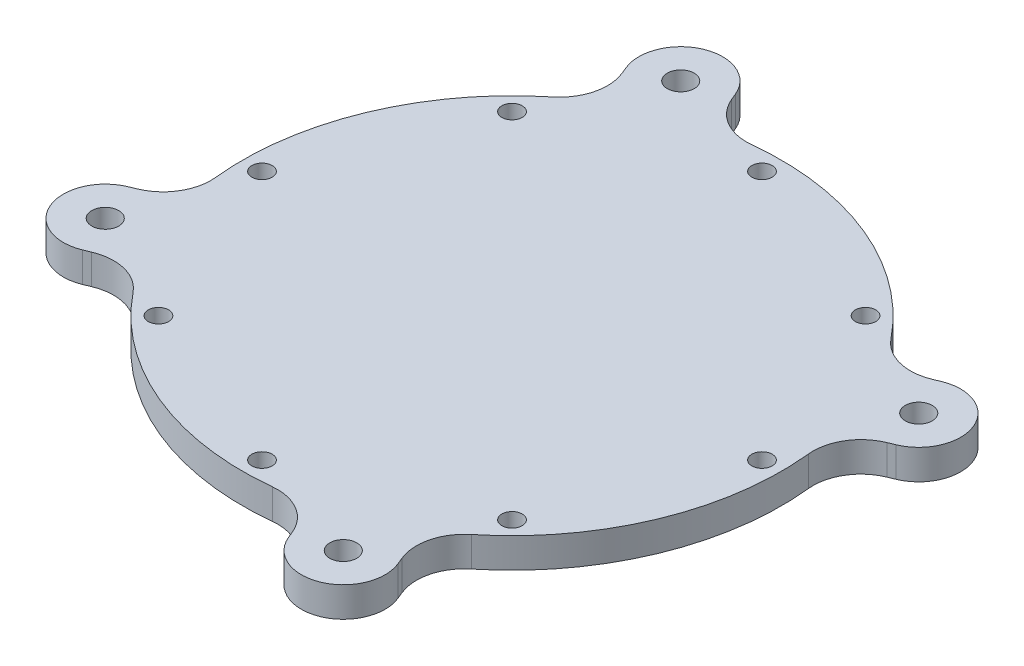
from build123d import *

# Parameters (mm, degrees)
SKETCH1_R                       = 45
SKETCH1_R_2                     = 1.5
BOSS_EXTRUDE2_DEPTH             = 5
SKETCH9_R                       = 3.937
BOSS_EXTRUDE7_DEPTH             = 4
SKETCH10_R                      = 1.7
CUT_EXTRUDE9_DEPTH              = 14
BOSS_EXTRUDE8_DEPTH             = 5
FILLET1_R                       = 8
SKETCH17_R                      = 8.317724374
BOSS_EXTRUDE9_DEPTH             = 10
CIRPATTERN1_COUNT               = 4
FILLET1_OF_CIRPATTERN1_R        = 8
CUT_EXTRUDE10_DEPTH             = 80.287191735
CUT_EXTRUDE10_DEPTH_BACK        = 80.287191735
SKETCH18_W                      = 16.635448748
SKETCH18_H                      = 10
SKETCH18_W_2                    = 61.874
SKETCH18_H_2                    = 4
M3X0_5_TAPPED_HOLE1_D           = 2.5
M3X0_5_TAPPED_HOLE1_DEPTH       = 3.248924226
M3X0_5_TAPPED_HOLE1_CSINK_D     = 3.05
M3X0_5_TAPPED_HOLE1_CSINK_ANGLE = 90
M3X0_5_TAPPED_HOLE1_TIP         = 0.751075774


with BuildPart() as part:
    # Sketch1 → Boss-Extrude2 (new body)
    with BuildSketch(Plane(origin=(0, 0, 0), x_dir=(1, 0, 0), z_dir=(0, 1, 0))):
        with Locations(Location((0, 0, 0), (0, 0, 270))):
            Circle(SKETCH1_R)
        with Locations(Location((0, 41.75, 0), (0, 0, 270))):
            Circle(SKETCH1_R_2, mode=Mode.SUBTRACT)
        with Locations(Location((29.521708115, 29.521708115, 0), (0, 0, 270))):
            Circle(SKETCH1_R_2, mode=Mode.SUBTRACT)
        with Locations(Location((41.75, 0, 0), (0, 0, 270))):
            Circle(SKETCH1_R_2, mode=Mode.SUBTRACT)
        with Locations(Location((29.521708115, -29.521708115, 0), (0, 0, 270))):
            Circle(SKETCH1_R_2, mode=Mode.SUBTRACT)
        with Locations(Location((0, -41.75, 0), (0, 0, 270))):
            Circle(SKETCH1_R_2, mode=Mode.SUBTRACT)
        with Locations(Location((-29.521708115, -29.521708115, 0), (0, 0, 270))):
            Circle(SKETCH1_R_2, mode=Mode.SUBTRACT)
        with Locations(Location((-41.75, 0, 0), (0, 0, 270))):
            Circle(SKETCH1_R_2, mode=Mode.SUBTRACT)
        with Locations(Location((-29.521708115, 29.521708115, 0), (0, 0, 270))):
            Circle(SKETCH1_R_2, mode=Mode.SUBTRACT)
    extrude(amount=BOSS_EXTRUDE2_DEPTH)

    # Sketch9 → Boss-Extrude7 (add)
    with BuildSketch(Plane.XZ):
        with Locations(Location((27, 0, 0), (0, 0, 90))):
            Circle(SKETCH9_R)
        with Locations(Location((0, -27, 0), (0, 0, 90))):
            Circle(SKETCH9_R)
        with Locations(Location((-27, 0, 0), (0, 0, 90))):
            Circle(SKETCH9_R)
        with Locations(Location((0, 27, 0), (0, 0, 90))):
            Circle(SKETCH9_R)
    extrude(amount=BOSS_EXTRUDE7_DEPTH)

    # Sketch10 → Cut-Extrude9 (cut)
    with BuildSketch(Plane(origin=(0, 5, 0), x_dir=(1, 0, 0), z_dir=(0, 1, 0))):
        with Locations(Location((0, 41.75, 0), (0, 0, 270))):
            Circle(SKETCH10_R)
        with Locations(Location((29.521708115, 29.521708115, 0), (0, 0, 270))):
            Circle(SKETCH10_R)
        with Locations(Location((41.75, 0, 0), (0, 0, 270))):
            Circle(SKETCH10_R)
        with Locations(Location((29.521708115, -29.521708115, 0), (0, 0, 270))):
            Circle(SKETCH10_R)
        with Locations(Location((0, -41.75, 0), (0, 0, 270))):
            Circle(SKETCH10_R)
        with Locations(Location((-29.521708115, -29.521708115, 0), (0, 0, 270))):
            Circle(SKETCH10_R)
        with Locations(Location((-41.75, 0, 0), (0, 0, 270))):
            Circle(SKETCH10_R)
        with Locations(Location((-29.521708115, 29.521708115, 0), (0, 0, 270))):
            Circle(SKETCH10_R)
    extrude(amount=-CUT_EXTRUDE9_DEPTH, mode=Mode.SUBTRACT)

    # Sketch16 → Boss-Extrude8 (add)
    with BuildSketch(Plane.XZ):
        with BuildLine():
            ThreePointArc((45.376634658, -26.343140039), (41.586295626, -22.556734731), (41.583514038, -17.199167429))
            ThreePointArc((41.583514038, -17.199167429), (40.114970744, -20.390907832), (38.401897955, -23.458351039))
            Line((38.401897955, -23.458351039), (45.376634658, -26.343140039))
        make_face()
        with BuildLine():
            Line((50.727486729, -13.406046775), (43.752750026, -10.521257775))
            ThreePointArc((43.752750026, -10.521257775), (42.798576033, -13.902585715), (41.583514038, -17.199167429))
            ThreePointArc((41.583514038, -17.199167429), (45.36991937, -13.408828339), (50.727486729, -13.406046775))
        make_face()
        with BuildLine():
            Line((45.972884991, -19.014635038), (41.583514062, -17.199167371))
            ThreePointArc((41.583514062, -17.199167371), (41.586295614, -22.556734702), (45.376634658, -26.343140039))
            Line((45.376634658, -26.343140039), (47.192102325, -21.95376911))
            ThreePointArc((47.192102325, -21.95376911), (45.973779061, -20.736710252), (45.972884991, -19.014635038))
        make_face()
        with BuildLine():
            ThreePointArc((50.727486729, -13.406046775), (45.369919398, -13.408828327), (41.583514062, -17.199167371))
            Line((41.583514062, -17.199167371), (45.972884991, -19.014635038))
            ThreePointArc((45.972884991, -19.014635038), (47.189943849, -17.796311774), (48.912019062, -17.795417704))
            Line((48.912019062, -17.795417704), (50.727486729, -13.406046775))
        make_face()
        with BuildLine():
            ThreePointArc((55.052060694, -19.874593407), (53.871338237, -15.984091013), (50.727486729, -13.406046775))
            Line((50.727486729, -13.406046775), (48.912019062, -17.795417704))
            ThreePointArc((48.912019062, -17.795417704), (49.922542761, -18.62407478), (50.302060694, -19.874593407))
            ThreePointArc((50.302060694, -19.874593407), (49.30257932, -21.745075474), (47.192102325, -21.95376911))
            Line((47.192102325, -21.95376911), (45.376634658, -26.343140039))
            ThreePointArc((45.376634658, -26.343140039), (51.942563088, -25.69387095), (55.052060694, -19.874593407))
        make_face()
    boss_extrude8 = extrude(amount=-BOSS_EXTRUDE8_DEPTH)

    # Fillet1
    fillet1_edges = [part.edges().sort_by_distance(p)[0] for p in [
        (38.401897955, 2.5, -23.458351039),
        (43.752750026, 2.5, -10.521257775),
    ]]
    fillet(fillet1_edges, radius=FILLET1_R)

    # Sketch17 → Boss-Extrude9 (add)
    with BuildSketch(Plane(origin=(0, 5, 0), x_dir=(1, 0, 0), z_dir=(0, 1, 0))):
        with Locations(Location((0, 0, 0), (0, 0, 270))):
            Circle(SKETCH17_R)
    extrude(amount=BOSS_EXTRUDE9_DEPTH)

    # CirPattern1: Boss-Extrude8 ×4 about axis
    cirpattern1_axis = Axis((0, 0, 0), (0, 1, 0))
    for i in range(1, CIRPATTERN1_COUNT):
        add(boss_extrude8.rotate(cirpattern1_axis, i * 360 / CIRPATTERN1_COUNT))

    # Fillet1 of CirPattern1
    fillet1_of_cirpattern1_edges = [part.edges().sort_by_distance(p)[0] for p in [
        (-23.458351039, 2.5, -38.401897955),
        (-10.521257775, 2.5, -43.752750026),
        (-38.401897955, 2.5, 23.458351039),
        (-43.752750026, 2.5, 10.521257775),
        (23.458351039, 2.5, 38.401897955),
        (10.521257775, 2.5, 43.752750026),
    ]]
    fillet(fillet1_of_cirpattern1_edges, radius=FILLET1_OF_CIRPATTERN1_R)

    # Sketch18 → Cut-Extrude10 (cut, two sides: drawn at the far end of the back side and taken through both)
    with BuildSketch(Plane.XY.offset(-CUT_EXTRUDE10_DEPTH_BACK)):
        with Locations((0, 10)):
            Rectangle(SKETCH18_W, SKETCH18_H)
        with Locations((0, -2)):
            Rectangle(SKETCH18_W_2, SKETCH18_H_2)
    extrude(amount=CUT_EXTRUDE10_DEPTH + CUT_EXTRUDE10_DEPTH_BACK, mode=Mode.SUBTRACT)

    # M3x0.5 Tapped Hole1
    with Locations(Plane(origin=(0, 0, 0), x_dir=(-1, 0, 0), z_dir=(0, -1, 0))):
        with Locations((-18.481561805, 7.644074387), (7.644074387, 18.481561805), (18.481561805, -7.644074387), (-7.644074387, -18.481561805)):
            CounterSinkHole(M3X0_5_TAPPED_HOLE1_D / 2, M3X0_5_TAPPED_HOLE1_CSINK_D / 2, depth=M3X0_5_TAPPED_HOLE1_DEPTH, counter_sink_angle=M3X0_5_TAPPED_HOLE1_CSINK_ANGLE)
            with Locations((0, 0, -(M3X0_5_TAPPED_HOLE1_DEPTH + M3X0_5_TAPPED_HOLE1_TIP / 2))):  # 118° drill point
                Cone(0, M3X0_5_TAPPED_HOLE1_D / 2, M3X0_5_TAPPED_HOLE1_TIP, mode=Mode.SUBTRACT)


solid = part.part
